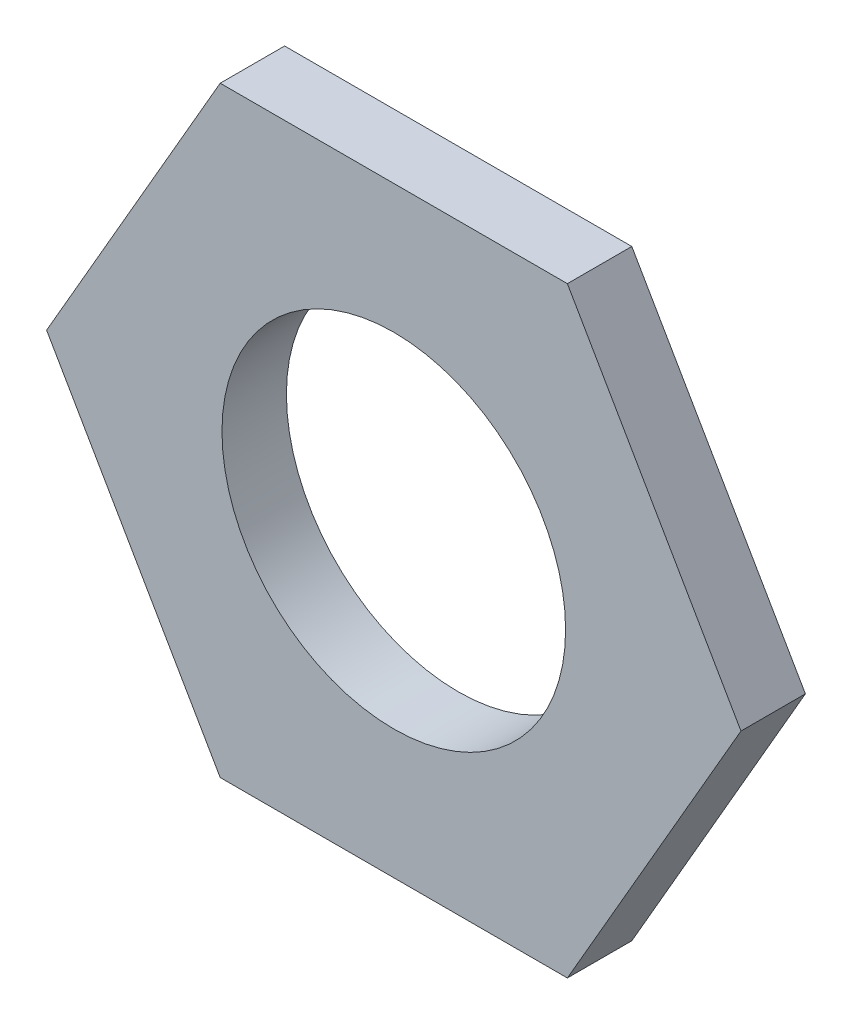
from build123d import *

# Parameters (mm, degrees)
SKETCH1_R           = 4
BOSS_EXTRUDE1_DEPTH = 1.5


with BuildPart() as part:
    # Sketch1 → Boss-Extrude1 (new body)
    with BuildSketch(Plane.XY):
        Polygon((47.14051893, -68.974353767), (55.223422699, -68.974353767), (59.264874583, -61.974353767), (55.223422699, -54.974353767), (47.14051893, -54.974353767), (43.099067046, -61.974353767), align=None)
        with Locations((51.181970815, -61.974353767)):
            Circle(SKETCH1_R, mode=Mode.SUBTRACT)
    extrude(amount=BOSS_EXTRUDE1_DEPTH)


solid = part.part
